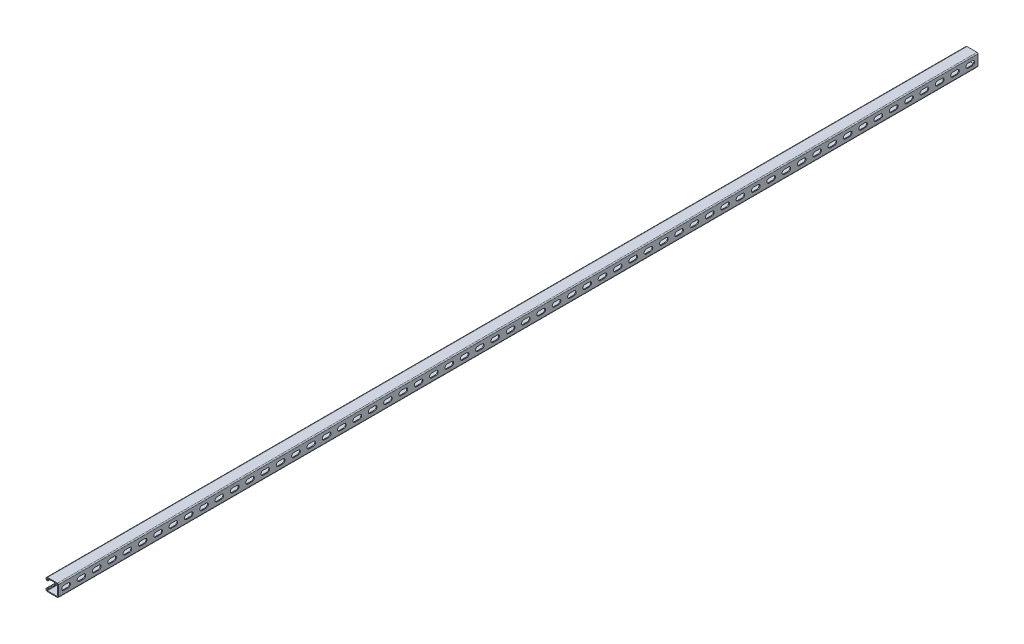
from build123d import *

# Parameters (mm, degrees)
BOSS_EXTRUDE1_DEPTH = 2540
BOSS_EXTRUDE2_DEPTH = 508
CUT_EXTRUDE1_DEPTH  = 2.794
LPATTERN1_COUNT     = 60
LPATTERN1_PITCH     = 50.8


with BuildPart() as part:
    # Sketch1 → Boss-Extrude1 (new body)
    with BuildSketch(Plane.XY):
        with BuildLine():
            Line((-36.22675, 20.6375), (-3.46075, 20.6375))
            ThreePointArc((-3.46075, 20.6375), (-1.013630207, 19.623869793), (0, 17.17675))
            Line((0, 17.17675), (0, -17.17675))
            ThreePointArc((0, -17.17675), (-1.013630207, -19.623869793), (-3.46075, -20.6375))
            Line((-3.46075, -20.6375), (-36.22675, -20.6375))
            ThreePointArc((-36.22675, -20.6375), (-39.796401808, -19.158901808), (-41.275, -15.58925))
            Line((-41.275, -15.58925), (-41.275, -14.57325))
            ThreePointArc((-41.275, -14.57325), (-40.261369793, -12.126130207), (-37.81425, -11.1125))
            Line((-37.81425, -11.1125), (-35.5346, -11.1125))
            ThreePointArc((-35.5346, -11.1125), (-34.1376, -12.5095), (-35.5346, -13.9065))
            Line((-35.5346, -13.9065), (-37.81425, -13.9065))
            ThreePointArc((-37.81425, -13.9065), (-38.285713446, -14.101786554), (-38.481, -14.57325))
            Line((-38.481, -14.57325), (-38.481, -15.58925))
            ThreePointArc((-38.481, -15.58925), (-37.820745461, -17.183245461), (-36.22675, -17.8435))
            Line((-36.22675, -17.8435), (-3.46075, -17.8435))
            ThreePointArc((-3.46075, -17.8435), (-2.989286554, -17.648213446), (-2.794, -17.17675))
            Line((-2.794, -17.17675), (-2.794, 17.17675))
            ThreePointArc((-2.794, 17.17675), (-2.989286554, 17.648213446), (-3.46075, 17.8435))
            Line((-3.46075, 17.8435), (-36.22675, 17.8435))
            ThreePointArc((-36.22675, 17.8435), (-37.820745461, 17.183245461), (-38.481, 15.58925))
            Line((-38.481, 15.58925), (-38.481, 14.57325))
            ThreePointArc((-38.481, 14.57325), (-38.285713446, 14.101786554), (-37.81425, 13.9065))
            Line((-37.81425, 13.9065), (-35.5346, 13.9065))
            ThreePointArc((-35.5346, 13.9065), (-34.1376, 12.5095), (-35.5346, 11.1125))
            Line((-35.5346, 11.1125), (-37.81425, 11.1125))
            ThreePointArc((-37.81425, 11.1125), (-40.261369793, 12.126130207), (-41.275, 14.57325))
            Line((-41.275, 14.57325), (-41.275, 15.58925))
            ThreePointArc((-41.275, 15.58925), (-39.796401808, 19.158901808), (-36.22675, 20.6375))
        make_face()
    extrude(amount=-BOSS_EXTRUDE1_DEPTH)

    # Sketch4 → Boss-Extrude2 (add)
    with BuildSketch(Plane(origin=(0, 0, -2540), x_dir=(-1, 0, 0), z_dir=(0, 0, -1))):
        with BuildLine():
            Line((36.22675, 20.6375), (3.46075, 20.6375))
            ThreePointArc((3.46075, 20.6375), (1.013630207, 19.623869793), (0, 17.17675))
            Line((0, 17.17675), (0, -17.17675))
            ThreePointArc((0, -17.17675), (1.013630207, -19.623869793), (3.46075, -20.6375))
            Line((3.46075, -20.6375), (36.22675, -20.6375))
            ThreePointArc((36.22675, -20.6375), (39.796401808, -19.158901808), (41.275, -15.58925))
            Line((41.275, -15.58925), (41.275, -14.57325))
            ThreePointArc((41.275, -14.57325), (40.261369793, -12.126130207), (37.81425, -11.1125))
            Line((37.81425, -11.1125), (35.5346, -11.1125))
            ThreePointArc((35.5346, -11.1125), (34.1376, -12.5095), (35.5346, -13.9065))
            Line((35.5346, -13.9065), (37.81425, -13.9065))
            ThreePointArc((37.81425, -13.9065), (38.285713446, -14.101786554), (38.481, -14.57325))
            Line((38.481, -14.57325), (38.481, -15.58925))
            ThreePointArc((38.481, -15.58925), (37.820745461, -17.183245461), (36.22675, -17.8435))
            Line((36.22675, -17.8435), (3.46075, -17.8435))
            ThreePointArc((3.46075, -17.8435), (2.989286554, -17.648213446), (2.794, -17.17675))
            Line((2.794, -17.17675), (2.794, 17.17675))
            ThreePointArc((2.794, 17.17675), (2.989286554, 17.648213446), (3.46075, 17.8435))
            Line((3.46075, 17.8435), (36.22675, 17.8435))
            ThreePointArc((36.22675, 17.8435), (37.820745461, 17.183245461), (38.481, 15.58925))
            Line((38.481, 15.58925), (38.481, 14.57325))
            ThreePointArc((38.481, 14.57325), (38.285713446, 14.101786554), (37.81425, 13.9065))
            Line((37.81425, 13.9065), (35.5346, 13.9065))
            ThreePointArc((35.5346, 13.9065), (34.1376, 12.5095), (35.5346, 11.1125))
            Line((35.5346, 11.1125), (37.81425, 11.1125))
            ThreePointArc((37.81425, 11.1125), (40.261369793, 12.126130207), (41.275, 14.57325))
            Line((41.275, 14.57325), (41.275, 15.58925))
            ThreePointArc((41.275, 15.58925), (39.796401808, 19.158901808), (36.22675, 20.6375))
        make_face()
    extrude(amount=BOSS_EXTRUDE2_DEPTH)

    # Sketch2 → Cut-Extrude1 (cut)
    with BuildSketch(Plane(origin=(0, 0, 0), x_dir=(0, 0, -1), z_dir=(1, 0, 0))):
        with BuildLine():
            Line((18.25625, 7.14375), (32.54375, 7.14375))
            ThreePointArc((32.54375, 7.14375), (39.6875, 0), (32.54375, -7.14375))
            Line((32.54375, -7.14375), (18.25625, -7.14375))
            ThreePointArc((18.25625, -7.14375), (11.1125, 0), (18.25625, 7.14375))
        make_face()
    cut_extrude1 = extrude(amount=-CUT_EXTRUDE1_DEPTH, mode=Mode.SUBTRACT)

    # LPattern1: Cut-Extrude1 ×60
    with Locations(*[(0, 0, -i * LPATTERN1_PITCH) for i in range(1, LPATTERN1_COUNT)]):
        add(cut_extrude1, mode=Mode.SUBTRACT)


solid = part.part
